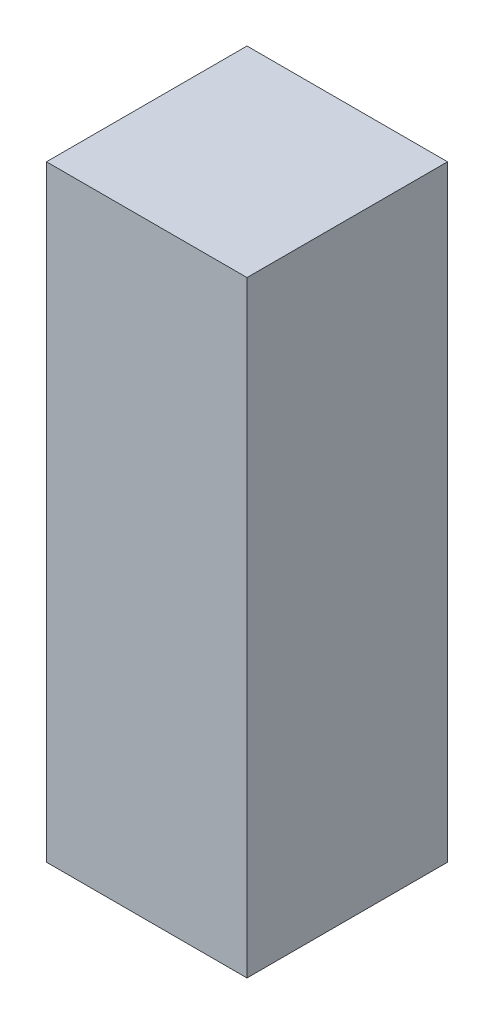
from build123d import *

# Parameters (mm, degrees)
SKETCH1_W           = 20
SKETCH1_H           = 20
BOSS_EXTRUDE1_DEPTH = 60.501274494


with BuildPart() as part:
    # Sketch1 → Boss-Extrude1 (new body)
    with BuildSketch(Plane(origin=(0, 0, 0), x_dir=(1, 0, 0), z_dir=(0, 1, 0))):
        with Locations((10, -10)):
            Rectangle(SKETCH1_W, SKETCH1_H)
    extrude(amount=BOSS_EXTRUDE1_DEPTH)


solid = part.part
